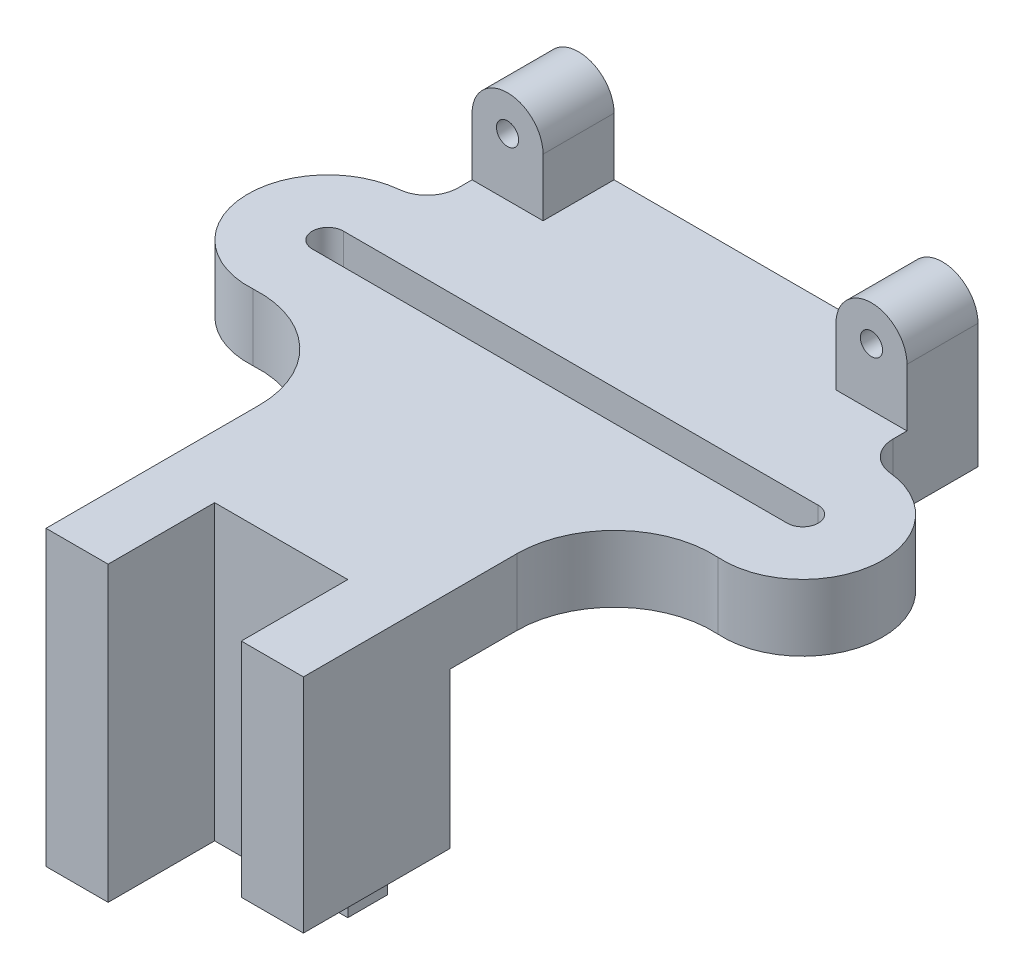
from build123d import *

# Parameters (mm, degrees)
BOSS_EXTRUDE1_DEPTH     = 15
SKETCH2_R               = 2.5
BOSS_EXTRUDE2_DEPTH     = 16
BOSS_EXTRUDE3_DEPTH     = 51
CUT_EXTRUDE1_DEPTH      = 140.202191075
CUT_EXTRUDE1_DEPTH_BACK = 140.202191075
SKETCH4_R               = 4.5
SKETCH4_W               = 14
SKETCH4_H               = 16


with BuildPart() as part:
    # Sketch1 → Boss-Extrude1 (new body)
    with BuildSketch(Plane(origin=(0, 0, 0), x_dir=(1, 0, 0), z_dir=(0, 1, 0))):
        with BuildLine():
            Line((49, 0), (-49, 0))
            Line((-49, 0), (-49, -19.125314072))
            ThreePointArc((-49, -19.125314072), (-50.808661059, -23.821056825), (-55.3, -26.090226132))
            ThreePointArc((-55.3, -26.090226132), (-71.440466452, -45.462758858), (-52.375, -61.964809351))
            ThreePointArc((-52.375, -61.964809351), (-35.937629669, -67.886680846), (-29, -83.921798557))
            Line((-29, -83.921798557), (-29, -132))
            Line((-29, -132), (-15, -132))
            Line((-15, -132), (-15, -108))
            Line((-15, -108), (15, -108))
            Line((15, -108), (15, -132))
            Line((15, -132), (29, -132))
            Line((29, -132), (29, -83.921798557))
            ThreePointArc((29, -83.921798557), (35.937629669, -67.886680846), (52.375, -61.964809351))
            ThreePointArc((52.375, -61.964809351), (71.440466452, -45.462758858), (55.3, -26.090226132))
            ThreePointArc((55.3, -26.090226132), (50.808661059, -23.821056825), (49, -19.125314072))
            Line((49, -19.125314072), (49, 0))
        make_face()
        with BuildLine():
            Line((-53.5, -40.5), (53.5, -40.5))
            ThreePointArc((53.5, -40.5), (57, -44), (53.5, -47.5))
            Line((53.5, -47.5), (-53.5, -47.5))
            ThreePointArc((-53.5, -47.5), (-57, -44), (-53.5, -40.5))
        make_face(mode=Mode.SUBTRACT)
    extrude(amount=BOSS_EXTRUDE1_DEPTH)

    # Sketch2 → Boss-Extrude2 (add)
    # profile 1 of 2: a face of its own
    with BuildSketch(Plane.XY):
        with BuildLine():
            Line((-49, 15), (-49, 28))
            ThreePointArc((-49, 28), (-41, 36), (-33, 28))
            Line((-33, 28), (-33, 15))
            Line((-33, 15), (-49, 15))
        make_face()
        with Locations((-41, 28)):
            Circle(SKETCH2_R, mode=Mode.SUBTRACT)
    # profile 2 of 2: a face of its own
    with BuildSketch(Plane.XY):
        with BuildLine():
            Line((33, 15), (49, 15))
            Line((49, 15), (49, 28))
            ThreePointArc((49, 28), (41, 36), (33, 28))
            Line((33, 28), (33, 15))
        make_face()
        with Locations(Location((41, 28, 0), (0, 0, 180))):
            Circle(SKETCH2_R, mode=Mode.SUBTRACT)
    extrude(amount=BOSS_EXTRUDE2_DEPTH)

    # Sketch3 → Boss-Extrude3 (add)
    with BuildSketch(Plane.XZ):
        Polygon((-15, 108), (15, 108), (15, 132), (29, 132), (29, 99), (-29, 99), (-29, 132), (-15, 132), align=None)
    extrude(amount=BOSS_EXTRUDE3_DEPTH)

    # Sketch4 → Cut-Extrude1 (cut, two sides: drawn at the far end of the back side and taken through both)
    with BuildSketch(Plane.XY.offset(108).offset(-CUT_EXTRUDE1_DEPTH_BACK)):
        with Locations((0, -18)):
            Circle(SKETCH4_R)
        with Locations((0, -40)):
            Circle(SKETCH4_R)
        with Locations((22, -43)):
            Rectangle(SKETCH4_W, SKETCH4_H)
    extrude(amount=CUT_EXTRUDE1_DEPTH + CUT_EXTRUDE1_DEPTH_BACK, mode=Mode.SUBTRACT)


solid = part.part
